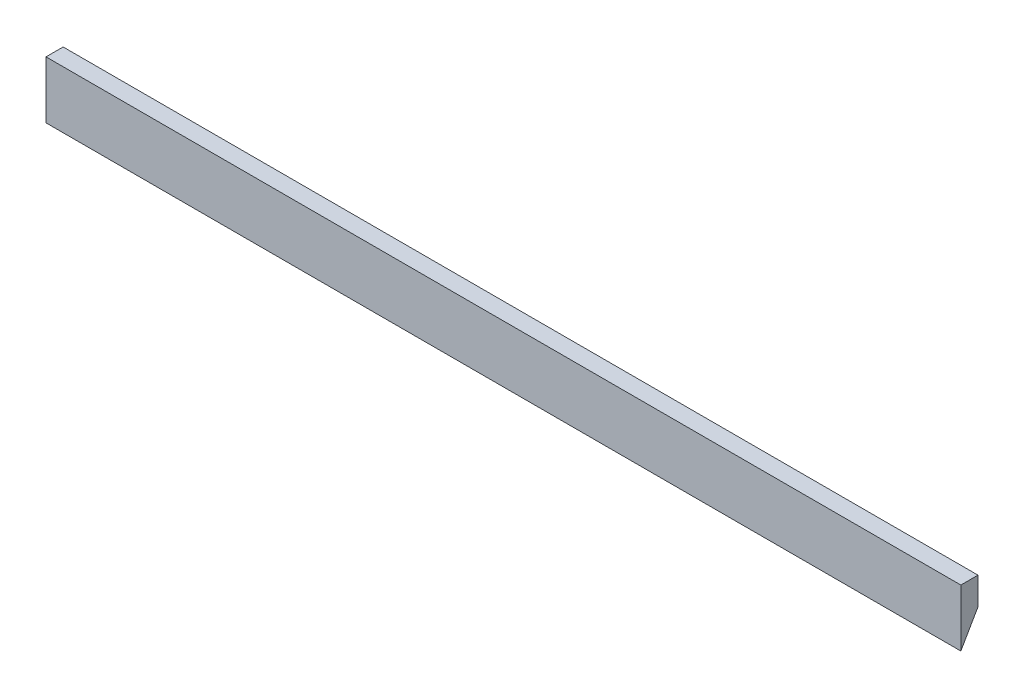
from build123d import *

# Parameters (mm, degrees)
CROQUIS1_W              = 160
CROQUIS1_H              = 10
SALIENTE_EXTRUIR1_DEPTH = 3
CORTAR_EXTRUIR1_DEPTH   = 161.106214745


with BuildPart() as part:
    # Croquis1 → Saliente-Extruir1 (new body)
    with BuildSketch(Plane.XY):
        Rectangle(CROQUIS1_W, CROQUIS1_H)
    extrude(amount=SALIENTE_EXTRUIR1_DEPTH)

    # Croquis2 → Cortar-Extruir1 (cut, through all)
    with BuildSketch(Plane.ZY.offset(80)):
        Polygon((0, -5), (3, -5), (0, 0.196152423), align=None)
    extrude(amount=-CORTAR_EXTRUIR1_DEPTH, mode=Mode.SUBTRACT)


solid = part.part
